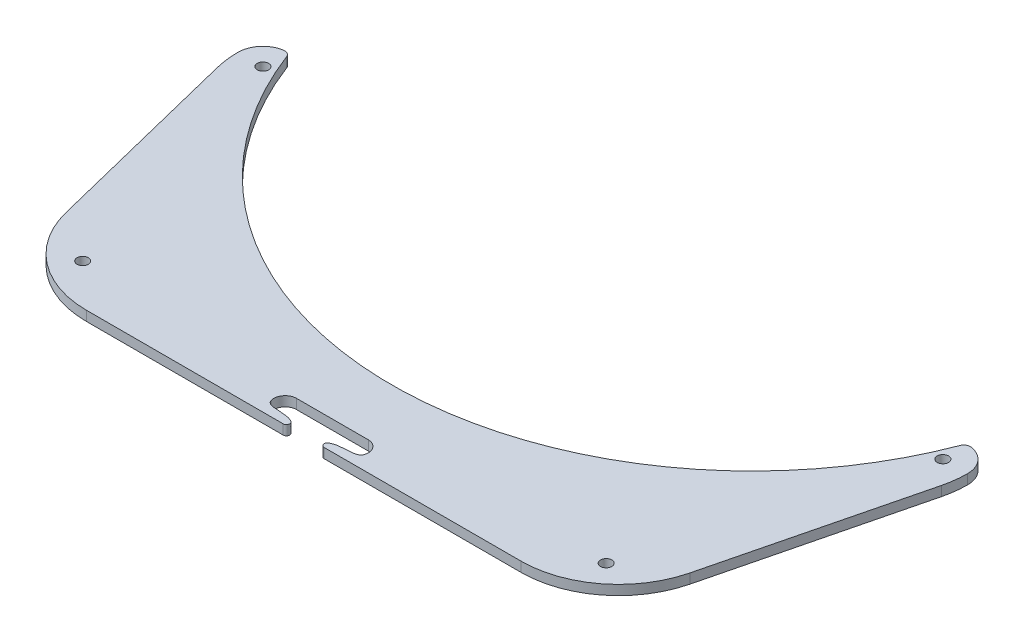
from build123d import *

# Parameters (mm, degrees)
EXTRUDE_1_DEPTH     = 3
CUT_EXTRUDE_1_DEPTH = 10
EXTRUDE_START       = -3
EXTRUDE_2_DEPTH     = 3
SKETCH_4_R          = 1.75
CUT_EXTRUDE_2_DEPTH = 10
CUT_EXTRUDE_3_DEPTH = 10


with BuildPart() as part:
    # 草图1 → 凸台-拉伸1 (new body)
    with BuildSketch(Plane(origin=(0, 0, 0), x_dir=(1, 0, 0), z_dir=(0, 1, 0))):
        with BuildLine():
            Line((-66.78059141, 154.593992167), (66.78059141, 154.593992167))
            ThreePointArc((66.78059141, 154.593992167), (85.265515034, 148.222525736), (95.898700635, 131.814498742))
            Line((95.898700635, 131.814498742), (111.265547961, 69.844672358))
            ThreePointArc((111.265547961, 69.844672358), (112.147438737, 62.624165782), (111.265547961, 55.403659207))
            Line((111.265547961, 55.403659207), (95.898700635, -6.566167178))
            ThreePointArc((95.898700635, -6.566167178), (85.265515034, -22.974194171), (66.78059141, -29.345660602))
            Line((66.78059141, -29.345660602), (-66.78059141, -29.345660602))
            ThreePointArc((-66.78059141, -29.345660602), (-85.265515034, -22.974194171), (-95.898700635, -6.566167178))
            Line((-95.898700635, -6.566167178), (-111.265547961, 55.403659207))
            ThreePointArc((-111.265547961, 55.403659207), (-112.147438737, 62.624165782), (-111.265547961, 69.844672358))
            Line((-111.265547961, 69.844672358), (-95.898700635, 131.814498742))
            ThreePointArc((-95.898700635, 131.814498742), (-85.265515034, 148.222525736), (-66.78059141, 154.593992167))
        make_face()
    extrude(amount=EXTRUDE_1_DEPTH)

    # 草图2 → 切除-拉伸1 (cut)
    with BuildSketch(Plane.XZ):
        with BuildLine():
            Line((95.898700635, -131.814498742), (111.265547961, -69.844672358))
            ThreePointArc((111.265547961, -69.844672358), (112.145783913, -62.939263665), (111.410792816, -56.016888883))
            ThreePointArc((111.410792816, -56.016888883), (104.688448853, -60.381556842), (97.766986015, -56.340073582))
            ThreePointArc((97.766986015, -56.340073582), (0, 2.309946502), (-97.766986015, -56.340073582))
            ThreePointArc((-97.766986015, -56.340073582), (-104.688448853, -60.381556842), (-111.410792816, -56.016888883))
            ThreePointArc((-111.410792816, -56.016888883), (-112.145783913, -62.939263665), (-111.265547961, -69.844672358))
            Line((-111.265547961, -69.844672358), (-95.898700635, -131.814498742))
            ThreePointArc((-95.898700635, -131.814498742), (-85.265515034, -148.222525736), (-66.78059141, -154.593992167))
            Line((-66.78059141, -154.593992167), (66.78059141, -154.593992167))
            ThreePointArc((66.78059141, -154.593992167), (85.265515034, -148.222525736), (95.898700635, -131.814498742))
        make_face()
    extrude(amount=-CUT_EXTRUDE_1_DEPTH, mode=Mode.SUBTRACT)

    # 草图3 → 凸台-拉伸2 (add)
    with BuildSketch(Plane(origin=(0, 3, 0), x_dir=(1, 0, 0), z_dir=(0, 1, 0)).offset(EXTRUDE_START)):
        with BuildLine():
            Line((111.265547961, 55.403659207), (97.047161675, 55.012754554))
            ThreePointArc((97.047161675, 55.012754554), (100.513394998, 61.851126086), (103.498491265, 68.91280428))
            ThreePointArc((103.498491265, 68.91280428), (104.361855318, 69.927640036), (105.671102633, 70.174946664))
            ThreePointArc((105.671102633, 70.174946664), (110.30657274, 67.598027995), (112.147438737, 62.624165782))
            ThreePointArc((112.147438737, 62.624165782), (111.926149897, 58.98708431), (111.265547961, 55.403659207))
        make_face()
        with BuildLine():
            Line((-111.265547961, 55.403659207), (-97.047161675, 55.012754554))
            ThreePointArc((-97.047161675, 55.012754554), (-100.513394998, 61.851126086), (-103.498491265, 68.91280428))
            ThreePointArc((-103.498491265, 68.91280428), (-104.361855318, 69.927640036), (-105.671102633, 70.174946664))
            ThreePointArc((-105.671102633, 70.174946664), (-110.30657274, 67.598027995), (-112.147438737, 62.624165782))
            ThreePointArc((-112.147438737, 62.624165782), (-111.926149897, 58.98708431), (-111.265547961, 55.403659207))
        make_face()
    extrude(amount=EXTRUDE_2_DEPTH)

    # 草图4 → 切除-拉伸2 (cut)
    with BuildSketch(Plane(origin=(0, 3, 0), x_dir=(1, 0, 0), z_dir=(0, 1, 0))):
        with Locations(Location((104.507530951, 62.624165782, 0), (0, 0, 270))):
            Circle(SKETCH_4_R)
        with Locations(Location((-104.507530951, 62.624165782, 0), (0, 0, 270))):
            Circle(SKETCH_4_R)
        with Locations(Location((80.450184708, -16.818951307, 0), (0, 0, 270))):
            Circle(SKETCH_4_R)
        with Locations(Location((-80.450184708, -16.818951307, 0), (0, 0, 270))):
            Circle(SKETCH_4_R)
    extrude(amount=-CUT_EXTRUDE_2_DEPTH, mode=Mode.SUBTRACT)

    # 草图5 → 切除-拉伸3 (cut)
    with BuildSketch(Plane(origin=(0, 3, 0), x_dir=(1, 0, 0), z_dir=(0, 1, 0))):
        with BuildLine():
            Line((11.016648097, -20.513898252), (-11.016648097, -20.513898252))
            ThreePointArc((-11.016648097, -20.513898252), (-13.814702514, -21.911306641), (-14.378457093, -24.987674549))
            add(Edge.make_bspline(
                [(-14.378457093, -24.987674549), (-14.050661547, -26.11933694), (-10.489346867, -26.76009099), (-7.724749574, -26.493757466), (-5.904508816, -27.417302496), (-5.804576355, -27.473305111)],
                knots=[0, 0, 0, 0, 0.274123853, 0.745489655, 0.777393608, 0.777393608, 0.777393608, 0.777393608], degree=3))
            ThreePointArc((-5.804576355, -27.473305111), (-5.325885634, -28.59829127), (-6.293448421, -29.345660602))
            Line((-6.293448421, -29.345660602), (6.293448421, -29.345660602))
            ThreePointArc((6.293448421, -29.345660602), (5.325885634, -28.59829127), (5.804576355, -27.473305111))
            add(Edge.make_bspline(
                [(5.804576355, -27.473305111), (5.904508816, -27.417302496), (7.724749574, -26.493757466), (10.489346867, -26.76009099), (14.050661547, -26.11933694), (14.378457093, -24.987674549)],
                knots=[0, 0, 0, 0, 0.031903952, 0.503269754, 0.777393608, 0.777393608, 0.777393608, 0.777393608], degree=3))
            ThreePointArc((14.378457093, -24.987674549), (13.814702514, -21.911306641), (11.016648097, -20.513898252))
        make_face()
    extrude(amount=-CUT_EXTRUDE_3_DEPTH, mode=Mode.SUBTRACT)


solid = part.part
